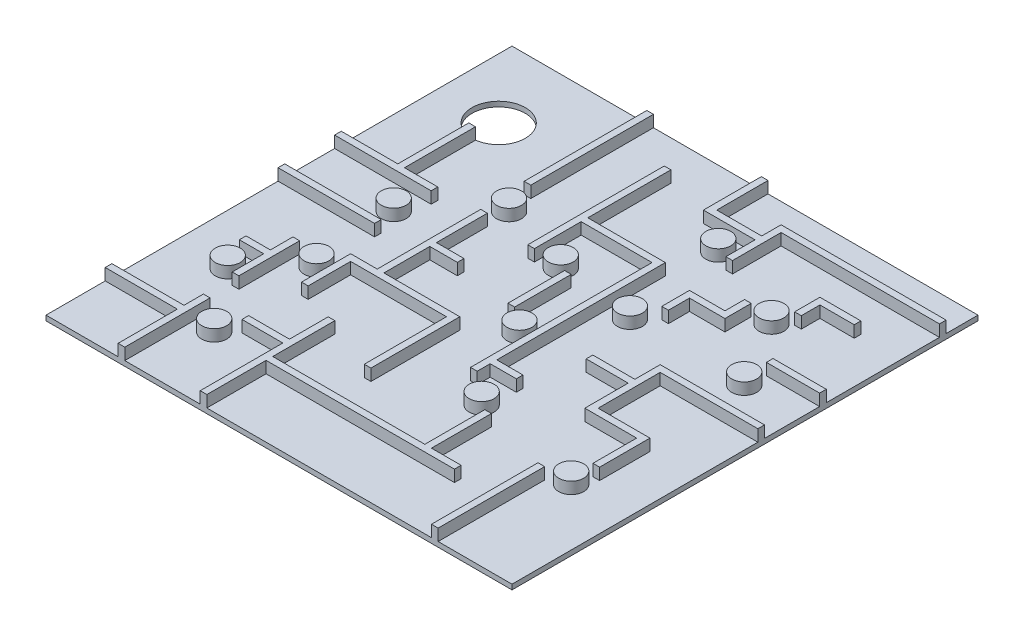
from build123d import *

# Parameters (mm, degrees)
SKETCH1_W           = 280
SKETCH1_H           = 280
SKETCH1_R           = 16
BOSS_EXTRUDE1_DEPTH = 1.5
SKETCH2_R           = 7.5
SKETCH2_W           = 4
SKETCH2_H           = 73.713198053
SKETCH2_W_2         = 58
SKETCH2_H_2         = 4
SKETCH2_H_3         = 64
SKETCH2_W_3         = 32
SKETCH2_H_4         = 34
BOSS_EXTRUDE2_DEPTH = 7


with BuildPart() as part:
    # Sketch1 → Boss-Extrude1 (new, symmetric)
    with BuildSketch(Plane(origin=(0, 0, 0), x_dir=(1, 0, 0), z_dir=(0, 1, 0))):
        Rectangle(SKETCH1_W, SKETCH1_H)
        with Locations(Location((-104, 96, 0), (0, 0, 270))):
            Circle(SKETCH1_R, mode=Mode.SUBTRACT)
    extrude(amount=BOSS_EXTRUDE1_DEPTH, both=True)

    # Sketch2 → Boss-Extrude2 (add)
    with BuildSketch(Plane(origin=(0, 1.5, 0), x_dir=(1, 0, 0), z_dir=(0, 1, 0))):
        with Locations(Location((-54.759044634, 52.982810669, 0), (0, 0, 270))):
            Circle(SKETCH2_R)
        with Locations(Location((-89.473504534, 18.412044198, 0), (0, 0, 270))):
            Circle(SKETCH2_R)
        with Locations(Location((-83.738928303, -33.690548853, 0), (0, 0, 270))):
            Circle(SKETCH2_R)
        with Locations(Location((-109.516269096, -61.269929812, 0), (0, 0, 270))):
            Circle(SKETCH2_R)
        with Locations(Location((-80.69273369, -98.230062392, 0), (0, 0, 270))):
            Circle(SKETCH2_R)
        with Locations(Location((37.587423323, -55.831973409, 0), (0, 0, 270))):
            Circle(SKETCH2_R)
        with Locations(Location((105.9104653, -70.333190482, 0), (0, 0, 270))):
            Circle(SKETCH2_R)
        with Locations(Location((11.819316554, -7.352500668, 0), (0, 0, 270))):
            Circle(SKETCH2_R)
        with Locations(Location((-9.755931913, 39.066973306, 0), (0, 0, 270))):
            Circle(SKETCH2_R)
        with Locations(Location((29.170109307, 94.80128466, 0), (0, 0, 270))):
            Circle(SKETCH2_R)
        with Locations(Location((82.624857116, 73.284632448, 0), (0, 0, 270))):
            Circle(SKETCH2_R)
        with Locations(Location((37.587423323, 33.266850719, 0), (0, 0, 270))):
            Circle(SKETCH2_R)
        with Locations(Location((106.252694304, 33.287862382, 0), (0, 0, 270))):
            Circle(SKETCH2_R)
        with Locations((-57, 103.143400974)):
            Rectangle(SKETCH2_W, SKETCH2_H)
        with BuildLine():
            Line((-140, 37.400802204), (-106, 37.400802204))
            Line((-106, 37.400802204), (-106, 80.125492134))
            ThreePointArc((-106, 80.125492134), (-104, 80), (-102, 80.125492134))
            Line((-102, 80.125492134), (-102, 37.400802204))
            Line((-102, 37.400802204), (-82, 37.400802204))
            Line((-82, 37.400802204), (-82, 33.400802204))
            Line((-82, 33.400802204), (-140, 33.400802204))
            Line((-140, 33.400802204), (-140, 37.400802204))
        make_face()
        Polygon((-140, -100.418377476), (-96.668523278, -100.418377476), (-96.668523278, -88.738640334), (-92.668523278, -88.738640334), (-92.668523278, -140), (-96.668523278, -140), (-96.668523278, -104.418377476), (-140, -104.418377476), align=None)
        with Locations((-111, 1.423286191)):
            Rectangle(SKETCH2_W_2, SKETCH2_H_2)
        Polygon((-47.345115434, -140), (-47.345115434, -90.364557891), (-71.881878867, -90.364557891), (-71.881878867, -86.364557891), (-47.345115434, -86.364557891), (-47.345115434, -63.088559208), (-43.345115434, -63.088559208), (-43.345115434, -100.418377476), (48.027751829, -100.418377476), (48.027751829, -64.371939455), (52.027751829, -64.371939455), (52.027751829, -100.418377476), (69.827851451, -100.418377476), (69.827851451, -104.418377476), (-43.345115434, -104.418377476), (-43.345115434, -140), align=None)
        Polygon((140, 7.737266613), (81.293142587, 7.737266613), (81.293142587, -29.543544834), (112.431248518, -29.543544834), (112.431248518, -59.777272974), (108.431248518, -59.777272974), (108.431248518, -33.543544834), (77.293142587, -33.543544834), (77.293142587, -7.47679166), (52.027751829, -7.47679166), (52.027751829, -3.47679166), (77.293142587, -3.47679166), (77.293142587, 11.737266613), (140, 11.737266613), align=None)
        with Locations((93.622601552, -108)):
            Rectangle(SKETCH2_W, SKETCH2_H_3)
        Polygon((-99.510735812, -32.111868954), (-95.510735812, -32.111868954), (-95.510735812, -68.594238703), (-99.510735812, -68.594238703), (-99.510735812, -49.675826938), (-114.127069846, -49.675826938), (-114.127069846, -45.675826938), (-99.510735812, -45.675826938), align=None)
        with Locations((124, 46.843999527)):
            Rectangle(SKETCH2_W_3, SKETCH2_H_2)
        Polygon((-73.435195895, -53.042459291), (-69.435195895, -53.042459291), (-69.435195895, -27.528186601), (-11.837088751, -27.528186601), (-11.837088751, -76.919702569), (-7.837088751, -76.919702569), (-7.837088751, -23.528186601), (-53.440050937, -23.528186601), (-53.440050937, 4.043094912), (-36.882667743, 4.043094912), (-36.882667743, 8.043094912), (-53.440050937, 8.043094912), (-53.440050937, 38.63118777), (-57.440050937, 38.63118777), (-57.440050937, -23.528186601), (-73.435195895, -23.528186601), align=None)
        Polygon((114.833141636, 94.80128466), (114.833141636, 90.80128466), (94.203549623, 90.80128466), (94.203549623, 79.625492134), (90.203549623, 79.625492134), (90.203549623, 94.80128466), align=None)
        with Locations((1.57904958, 15.009472223)):
            Rectangle(SKETCH2_W, SKETCH2_H_4)
        Polygon((68.742119222, 71), (68.742119222, 59.19860167), (47.447056499, 59.19860167), (47.447056499, 42.554658178), (51.447056499, 42.554658178), (51.447056499, 55.19860167), (72.742119222, 55.19860167), (72.742119222, 71), align=None)
        Polygon((21.727135977, -46.6315684), (25.727135977, -46.6315684), (25.727135977, -38.844500644), (41.459511743, -38.844500644), (41.459511743, -34.844500644), (25.727135977, -34.844500644), (25.727135977, 66.420221849), (-20.87255933, 66.420221849), (-20.87255933, 116.344219933), (-24.87255933, 116.344219933), (-24.87255933, 34.358038326), (-20.87255933, 34.358038326), (-20.87255933, 62.420221849), (21.727135977, 62.420221849), align=None)
        Polygon((140, 116.845058218), (44.841725693, 116.845058218), (44.841725693, 87.65657302), (40.841725693, 87.65657302), (40.841725693, 105.182034885), (9.848778982, 105.182034885), (9.848778982, 140), (13.848778982, 140), (13.848778982, 109.182034885), (40.841725693, 109.182034885), (40.841725693, 120.845058218), (140, 120.845058218), align=None)
    extrude(amount=BOSS_EXTRUDE2_DEPTH)


solid = part.part
